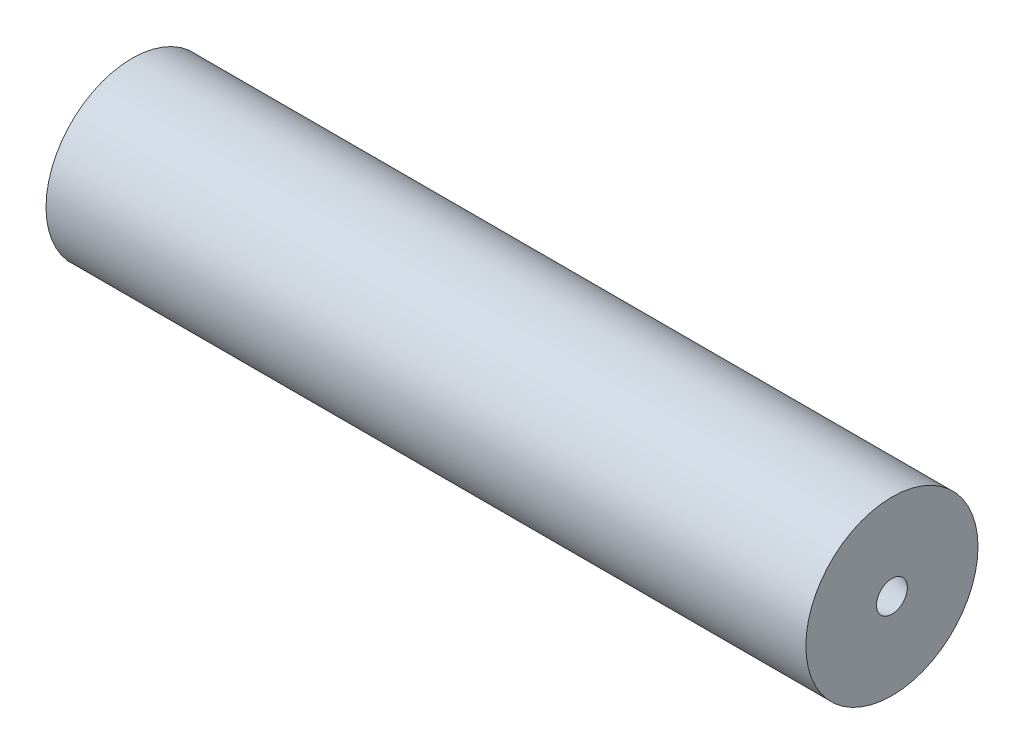
from build123d import *

# Parameters (mm, degrees)
CUT_EXTRUDE1_REACH = 247.25
SKETCH3_R          = 0.80645


with BuildPart() as part:
    # Sketch1 → Revolve1 (revolve)
    with BuildSketch(Plane.XY, mode=Mode.PRIVATE) as revolve1_sk:
        Polygon((0, 12.7), (196.85, 12.7), (196.85, 26.162), (241.3, 26.162), (241.3, 0), (259.36, 0), (259.36, 10.7696), (273.6661, 5.5626), (273.6661, 31), (0, 31), align=None)
    revolve(revolve1_sk.sketch.rotate(Axis((0, 0, 0), (1, 0, 0)), 90), axis=Axis((0, 0, 0), (1, 0, 0)))

    # Sketch3 → Cut-Extrude1 (cut, up to next)
    with BuildSketch(Plane.ZY.offset(-241.3), mode=Mode.PRIVATE) as cut_extrude1_sk1:
        with Locations((0, 6.477)):
            Circle(SKETCH3_R)
    cut_extrude1_tool1 = extrude(cut_extrude1_sk1.sketch, amount=-CUT_EXTRUDE1_REACH, mode=Mode.PRIVATE) & part.part
    # Sketch3 → Cut-Extrude1 (cut, up to next)
    with BuildSketch(Plane.ZY.offset(-241.3), mode=Mode.PRIVATE) as cut_extrude1_sk2:
        with Locations((4.579930622, 4.579930622)):
            Circle(SKETCH3_R)
    cut_extrude1_tool2 = extrude(cut_extrude1_sk2.sketch, amount=-CUT_EXTRUDE1_REACH, mode=Mode.PRIVATE) & part.part
    # Sketch3 → Cut-Extrude1 (cut, up to next)
    with BuildSketch(Plane.ZY.offset(-241.3), mode=Mode.PRIVATE) as cut_extrude1_sk3:
        with Locations((6.477, 0)):
            Circle(SKETCH3_R)
    cut_extrude1_tool3 = extrude(cut_extrude1_sk3.sketch, amount=-CUT_EXTRUDE1_REACH, mode=Mode.PRIVATE) & part.part
    # Sketch3 → Cut-Extrude1 (cut, up to next)
    with BuildSketch(Plane.ZY.offset(-241.3), mode=Mode.PRIVATE) as cut_extrude1_sk4:
        with Locations((4.579930622, -4.579930622)):
            Circle(SKETCH3_R)
    cut_extrude1_tool4 = extrude(cut_extrude1_sk4.sketch, amount=-CUT_EXTRUDE1_REACH, mode=Mode.PRIVATE) & part.part
    # Sketch3 → Cut-Extrude1 (cut, up to next)
    with BuildSketch(Plane.ZY.offset(-241.3), mode=Mode.PRIVATE) as cut_extrude1_sk5:
        with Locations((0, -6.477)):
            Circle(SKETCH3_R)
    cut_extrude1_tool5 = extrude(cut_extrude1_sk5.sketch, amount=-CUT_EXTRUDE1_REACH, mode=Mode.PRIVATE) & part.part
    # Sketch3 → Cut-Extrude1 (cut, up to next)
    with BuildSketch(Plane.ZY.offset(-241.3), mode=Mode.PRIVATE) as cut_extrude1_sk6:
        with Locations((-4.579930622, -4.579930622)):
            Circle(SKETCH3_R)
    cut_extrude1_tool6 = extrude(cut_extrude1_sk6.sketch, amount=-CUT_EXTRUDE1_REACH, mode=Mode.PRIVATE) & part.part
    # Sketch3 → Cut-Extrude1 (cut, up to next)
    with BuildSketch(Plane.ZY.offset(-241.3), mode=Mode.PRIVATE) as cut_extrude1_sk7:
        with Locations((-6.477, 0)):
            Circle(SKETCH3_R)
    cut_extrude1_tool7 = extrude(cut_extrude1_sk7.sketch, amount=-CUT_EXTRUDE1_REACH, mode=Mode.PRIVATE) & part.part
    # Sketch3 → Cut-Extrude1 (cut, up to next)
    with BuildSketch(Plane.ZY.offset(-241.3), mode=Mode.PRIVATE) as cut_extrude1_sk8:
        with Locations((-4.579930622, 4.579930622)):
            Circle(SKETCH3_R)
    cut_extrude1_tool8 = extrude(cut_extrude1_sk8.sketch, amount=-CUT_EXTRUDE1_REACH, mode=Mode.PRIVATE) & part.part
    add(cut_extrude1_tool1.solids().sort_by_distance((241.3, 6.477, 0))[0], mode=Mode.SUBTRACT)
    add(cut_extrude1_tool2.solids().sort_by_distance((241.3, 4.579931, 4.579931))[0], mode=Mode.SUBTRACT)
    add(cut_extrude1_tool3.solids().sort_by_distance((241.3, 0, 6.477))[0], mode=Mode.SUBTRACT)
    add(cut_extrude1_tool4.solids().sort_by_distance((241.3, -4.579931, 4.579931))[0], mode=Mode.SUBTRACT)
    add(cut_extrude1_tool5.solids().sort_by_distance((241.3, -6.477, 0))[0], mode=Mode.SUBTRACT)
    add(cut_extrude1_tool6.solids().sort_by_distance((241.3, -4.579931, -4.579931))[0], mode=Mode.SUBTRACT)
    add(cut_extrude1_tool7.solids().sort_by_distance((241.3, 0, -6.477))[0], mode=Mode.SUBTRACT)
    add(cut_extrude1_tool8.solids().sort_by_distance((241.3, 4.579931, -4.579931))[0], mode=Mode.SUBTRACT)


solid = part.part
